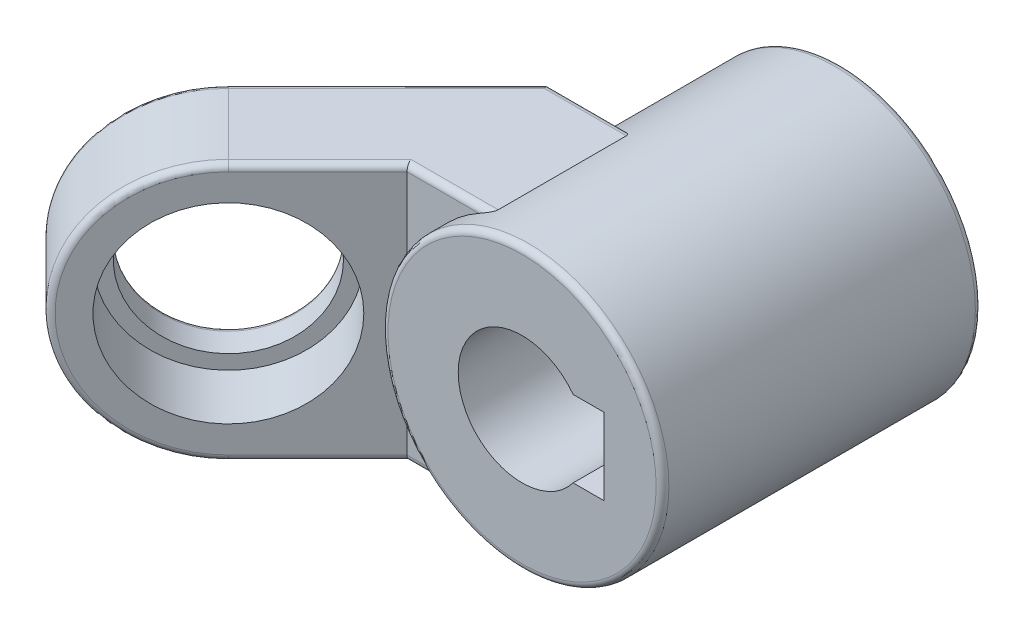
from build123d import *

# Parameters (mm, degrees)
ESQUISSE1_R             = 22
BOSS_EXTRU_1_DEPTH      = 50
BOSS_EXTRU_3_DEPTH      = 20.2
BOSS_EXTRU_3_DEPTH_BACK = 20.2
ENL_V_MAT_EXTRU_1_REACH = 100.801
ESQUISSE6_R             = 15
ENL_V_MAT_EXTRU_2_DEPTH = 10.3
ENL_V_MAT_EXTRU_3_REACH = 100.406
ESQUISSE7_R             = 12.75
CONG_1_R                = 1
ESQUISSE8_R             = 18
ENL_V_MAT_EXTRU_4_DEPTH = 2
ENL_V_START             = -15.6
ENL_V_MAT_EXTRU_5_DEPTH = 15.6
CONG_5_R                = 1


with BuildPart() as part:
    # Esquisse1 → Boss.-Extru.1 (new body)
    with BuildSketch(Plane.XY):
        Circle(ESQUISSE1_R)
    extrude(amount=BOSS_EXTRU_1_DEPTH)

    # Esquisse4 → Boss.-Extru.3 (add, two sides: drawn at the far end of the back side and taken through both)
    with BuildSketch(Plane.XZ.offset(-BOSS_EXTRU_3_DEPTH_BACK)):
        Polygon((-35.991735162, 60.008264838), (-50.275292142, 74.291821818), (-61.306157929, 63.260956031), (-22, 23.954798102), (0, 23.954798102), (0, 46.016529675), (-22, 46.016529675), align=None)
    extrude(amount=BOSS_EXTRU_3_DEPTH + BOSS_EXTRU_3_DEPTH_BACK)

    # Esquisse5 → Enlèv. mat.-Extru.1 (cut, up to next)
    with BuildSketch(Plane(origin=(0, 0, 0), x_dir=(-1, 0, 0), z_dir=(0, 0, -1)), mode=Mode.PRIVATE) as enl_v_mat_extru_1_sk1:
        with BuildLine():
            Line((-12.8, -6), (-12.8, 6))
            Line((-12.8, 6), (-8, 6))
            ThreePointArc((-8, 6), (10, 0), (-8, -6))
            Line((-8, -6), (-12.8, -6))
        make_face()
    enl_v_mat_extru_1_tool1 = extrude(enl_v_mat_extru_1_sk1.sketch, amount=-ENL_V_MAT_EXTRU_1_REACH, mode=Mode.PRIVATE) & part.part
    add(enl_v_mat_extru_1_tool1.solids().sort_by_distance((1.280327, 0, 0))[0], mode=Mode.SUBTRACT)

    # Esquisse6 → Enlèv. mat.-Extru.2 (cut)
    with BuildSketch(Plane(origin=(12.008264838, 0, 12.008264838), x_dir=(0.7071067811865508, 0, -0.7071067811865444), z_dir=(0.7071067811865444, 0, 0.7071067811865508))):
        with Locations((-67.882250994, 0)):
            Circle(ESQUISSE6_R)
    extrude(amount=-ENL_V_MAT_EXTRU_2_DEPTH, mode=Mode.SUBTRACT)

    # Esquisse7 → Enlèv. mat.-Extru.3 (cut, up to next)
    with BuildSketch(Plane(origin=(4.725064991, 0, 4.725064991), x_dir=(0.7071067811865507, 0, -0.7071067811865445), z_dir=(0.7071067811865445, 0, 0.7071067811865507)), mode=Mode.PRIVATE) as enl_v_mat_extru_3_sk1:
        with Locations((-67.882250994, 0)):
            Circle(ESQUISSE7_R)
    enl_v_mat_extru_3_tool1 = extrude(enl_v_mat_extru_3_sk1.sketch, amount=-ENL_V_MAT_EXTRU_3_REACH, mode=Mode.PRIVATE) & part.part
    add(enl_v_mat_extru_3_tool1.solids().sort_by_distance((-43.274935, 0, 52.725065))[0], mode=Mode.SUBTRACT)

    # Congé1
    cong_1_edges = [part.edges().sort_by_distance(p)[0] for p in [
        (-56.038212409, 0, 57.993010511),
    ]]
    fillet(cong_1_edges, radius=CONG_1_R)

    # Esquisse8 → Enlèv. mat.-Extru.4 (cut)
    with BuildSketch(Plane(origin=(0, 0, 0), x_dir=(-1, 0, 0), z_dir=(0, 0, -1))):
        Circle(ESQUISSE8_R)
    extrude(amount=-ENL_V_MAT_EXTRU_4_DEPTH, mode=Mode.SUBTRACT)

    # Esquisse10 → Enlèv. mat.-Extru.5 (cut)
    with BuildSketch(Plane(origin=(12.008264838, 0, 12.008264838), x_dir=(0.7071067811865509, 0, -0.7071067811865442), z_dir=(0.7071067811865442, 0, 0.7071067811865509)).offset(ENL_V_START)):
        with BuildLine():
            Line((-67.882250994, 20.2), (-92.882250994, 20.2))
            Line((-92.882250994, 20.2), (-92.882250994, -20.2))
            Line((-92.882250994, -20.2), (-67.882250994, -20.2))
            ThreePointArc((-67.882250994, -20.2), (-88.082250994, 0), (-67.882250994, 20.2))
        make_face()
    extrude(amount=ENL_V_MAT_EXTRU_5_DEPTH, mode=Mode.SUBTRACT)

    # Congé5
    cong_5_edges = [part.edges().sort_by_distance(p)[0] for p in [
        (-15.357751714, 20.2, 23.954798102),
        (-15.357751714, -20.2, 23.954798102),
        (-15.357751714, -20.2, 46.016529675),
        (-28.995867581, -20.2, 53.012397256),
        (-28.995867581, 20.2, 53.012397256),
        (-22, 0, 0),
        (-22, 0, 50),
        (-34.511300474, -20.2, 36.466098577),
        (-50.275292142, 0, 74.291821818),
        (-61.306157929, 0, 63.260956031),
        (-34.511300474, 20.2, 36.466098577),
        (-15.357751714, 20.2, 46.016529675),
    ]]
    fillet(cong_5_edges, radius=CONG_5_R)


solid = part.part
